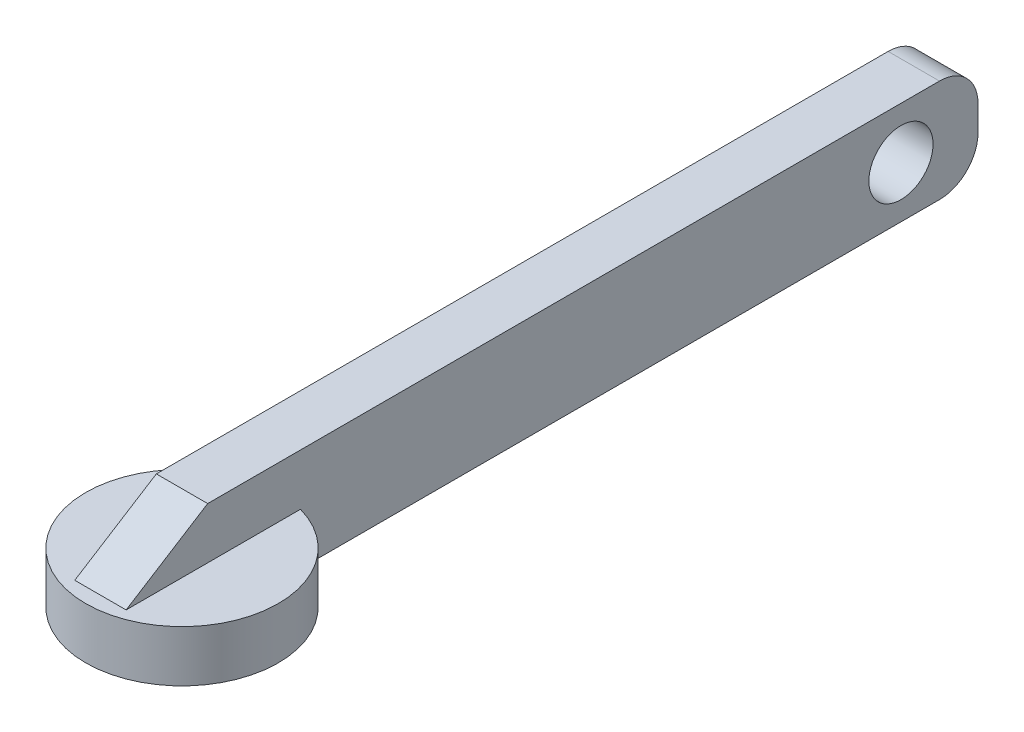
from build123d import *

# Parameters (mm, degrees)
SKETCH1_W           = 4
SKETCH1_H           = 60
BOSS_EXTRUDE1_DEPTH = 8
SKETCH2_R           = 2.5
CUT_EXTRUDE1_DEPTH  = 8
FILLET1_R           = 3
SKETCH3_R           = 7.5
BOSS_EXTRUDE2_DEPTH = 4
BOSS_EXTRUDE3_DEPTH = 4


with BuildPart() as part:
    # Sketch1 → Boss-Extrude1 (new body)
    with BuildSketch(Plane(origin=(0, 0, 0), x_dir=(1, 0, 0), z_dir=(0, 1, 0))):
        Rectangle(SKETCH1_W, SKETCH1_H)
    extrude(amount=BOSS_EXTRUDE1_DEPTH)

    # Sketch2 → Cut-Extrude1 (cut)
    with BuildSketch(Plane.ZY.offset(2)):
        with Locations((-24, 4)):
            Circle(SKETCH2_R)
    extrude(amount=-CUT_EXTRUDE1_DEPTH, mode=Mode.SUBTRACT)

    # Fillet1
    fillet1_edges = [part.edges().sort_by_distance(p)[0] for p in [
        (0, 0, -30),
        (0, 8, -30),
    ]]
    fillet(fillet1_edges, radius=FILLET1_R)

    # Sketch3 → Boss-Extrude2 (add)
    with BuildSketch(Plane.XZ):
        with Locations((0, 30)):
            Circle(SKETCH3_R)
    extrude(amount=-BOSS_EXTRUDE2_DEPTH)

    # Sketch4 → Boss-Extrude3 (add)
    with BuildSketch(Plane(origin=(2, 0, 0), x_dir=(0, 0, -1), z_dir=(1, 0, 0))):
        Polygon((-30, 4), (-36.351721889, 4), (-30, 8), align=None)
    extrude(amount=-BOSS_EXTRUDE3_DEPTH)


solid = part.part
